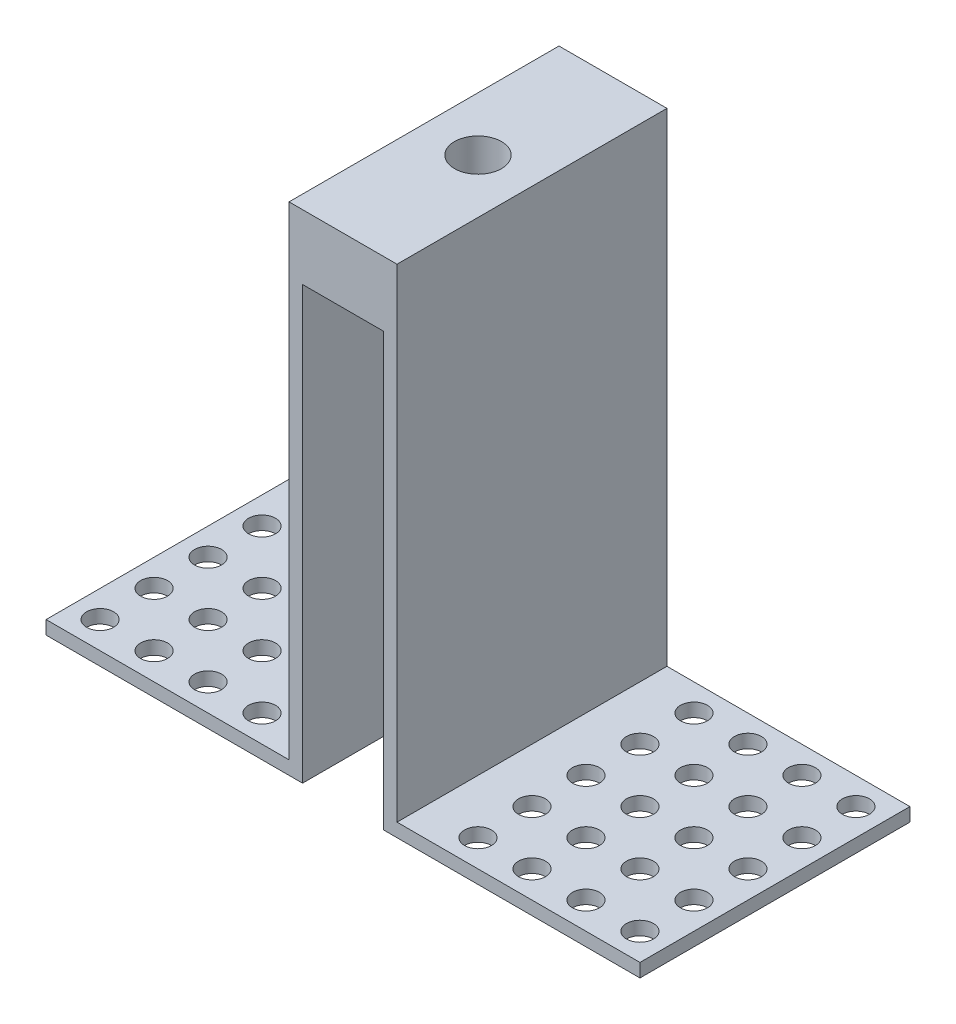
from build123d import *

# Parameters (mm, degrees)
SKETCH1_W           = 25.4
SKETCH1_H           = 63.5
SKETCH1_R           = 5.5245
BOSS_EXTRUDE1_DEPTH = 15.24
BOSS_EXTRUDE2_DEPTH = 63.5
SKETCH5_R           = 3.175
CUT_EXTRUDE3_DEPTH  = 138.137949616


with BuildPart() as part:
    # Sketch1 → Boss-Extrude1 (new body)
    with BuildSketch(Plane(origin=(0, 0, 0), x_dir=(1, 0, 0), z_dir=(0, 1, 0))):
        Rectangle(SKETCH1_W, SKETCH1_H)
        with Locations(Location((0, 0, 0), (0, 0, 90))):
            Circle(SKETCH1_R, mode=Mode.SUBTRACT)
    extrude(amount=BOSS_EXTRUDE1_DEPTH)

    # Sketch2 → Boss-Extrude2 (add)
    with BuildSketch(Plane.XY.offset(31.75)):
        Polygon((-9.525, 0), (-12.7, 0), (-12.7, -98.425), (-69.85, -98.425), (-69.85, -101.6), (-38.1, -101.6), (-9.525, -101.6), align=None)
    boss_extrude2 = extrude(amount=-BOSS_EXTRUDE2_DEPTH)

    # Mirror1: Boss-Extrude2 across plane
    add(boss_extrude2.mirror(Plane(origin=(0, 0, 0), x_dir=(0, 0, 1), z_dir=(1, 0, 0))))

    # Sketch5 → Cut-Extrude3 (cut, through all)
    with BuildSketch(Plane(origin=(0, -98.425, 0), x_dir=(1, 0, 0), z_dir=(0, 1, 0))):
        with Locations(Location((63.5, -25.4, 0), (0, 0, 180))):
            Circle(SKETCH5_R)
        with Locations(Location((50.8, -25.4, 0), (0, 0, 180))):
            Circle(SKETCH5_R)
        with Locations(Location((38.1, -25.4, 0), (0, 0, 180))):
            Circle(SKETCH5_R)
        with Locations(Location((25.4, -25.4, 0), (0, 0, 180))):
            Circle(SKETCH5_R)
        with Locations(Location((50.8, -12.7, 0), (0, 0, 180))):
            Circle(SKETCH5_R)
        with Locations(Location((38.1, -12.7, 0), (0, 0, 180))):
            Circle(SKETCH5_R)
        with Locations(Location((25.4, -12.7, 0), (0, 0, 180))):
            Circle(SKETCH5_R)
        with Locations(Location((50.8, 0, 0), (0, 0, 180))):
            Circle(SKETCH5_R)
        with Locations(Location((38.1, 0, 0), (0, 0, 180))):
            Circle(SKETCH5_R)
        with Locations(Location((25.4, 0, 0), (0, 0, 180))):
            Circle(SKETCH5_R)
        with Locations(Location((50.8, 12.7, 0), (0, 0, 180))):
            Circle(SKETCH5_R)
        with Locations(Location((38.1, 12.7, 0), (0, 0, 180))):
            Circle(SKETCH5_R)
        with Locations(Location((25.4, 12.7, 0), (0, 0, 180))):
            Circle(SKETCH5_R)
        with Locations(Location((50.8, 25.4, 0), (0, 0, 180))):
            Circle(SKETCH5_R)
        with Locations(Location((38.1, 25.4, 0), (0, 0, 180))):
            Circle(SKETCH5_R)
        with Locations(Location((25.4, 25.4, 0), (0, 0, 180))):
            Circle(SKETCH5_R)
        with Locations(Location((63.5, -12.7, 0), (0, 0, 180))):
            Circle(SKETCH5_R)
        with Locations(Location((63.5, 0, 0), (0, 0, 180))):
            Circle(SKETCH5_R)
        with Locations(Location((63.5, 12.7, 0), (0, 0, 180))):
            Circle(SKETCH5_R)
        with Locations(Location((63.5, 25.4, 0), (0, 0, 180))):
            Circle(SKETCH5_R)
        with Locations((-63.5, 25.4)):
            Circle(SKETCH5_R)
        with Locations((-63.5, 12.7)):
            Circle(SKETCH5_R)
        with Locations((-63.5, 0)):
            Circle(SKETCH5_R)
        with Locations((-63.5, -12.7)):
            Circle(SKETCH5_R)
        with Locations((-25.4, 25.4)):
            Circle(SKETCH5_R)
        with Locations((-38.1, 25.4)):
            Circle(SKETCH5_R)
        with Locations((-50.8, 25.4)):
            Circle(SKETCH5_R)
        with Locations((-25.4, 12.7)):
            Circle(SKETCH5_R)
        with Locations((-38.1, 12.7)):
            Circle(SKETCH5_R)
        with Locations((-50.8, 12.7)):
            Circle(SKETCH5_R)
        with Locations((-25.4, 0)):
            Circle(SKETCH5_R)
        with Locations((-38.1, 0)):
            Circle(SKETCH5_R)
        with Locations((-50.8, 0)):
            Circle(SKETCH5_R)
        with Locations((-25.4, -12.7)):
            Circle(SKETCH5_R)
        with Locations((-38.1, -12.7)):
            Circle(SKETCH5_R)
        with Locations((-50.8, -12.7)):
            Circle(SKETCH5_R)
        with Locations((-25.4, -25.4)):
            Circle(SKETCH5_R)
        with Locations((-38.1, -25.4)):
            Circle(SKETCH5_R)
        with Locations((-50.8, -25.4)):
            Circle(SKETCH5_R)
        with Locations((-63.5, -25.4)):
            Circle(SKETCH5_R)
    extrude(amount=-CUT_EXTRUDE3_DEPTH, mode=Mode.SUBTRACT)


solid = part.part
